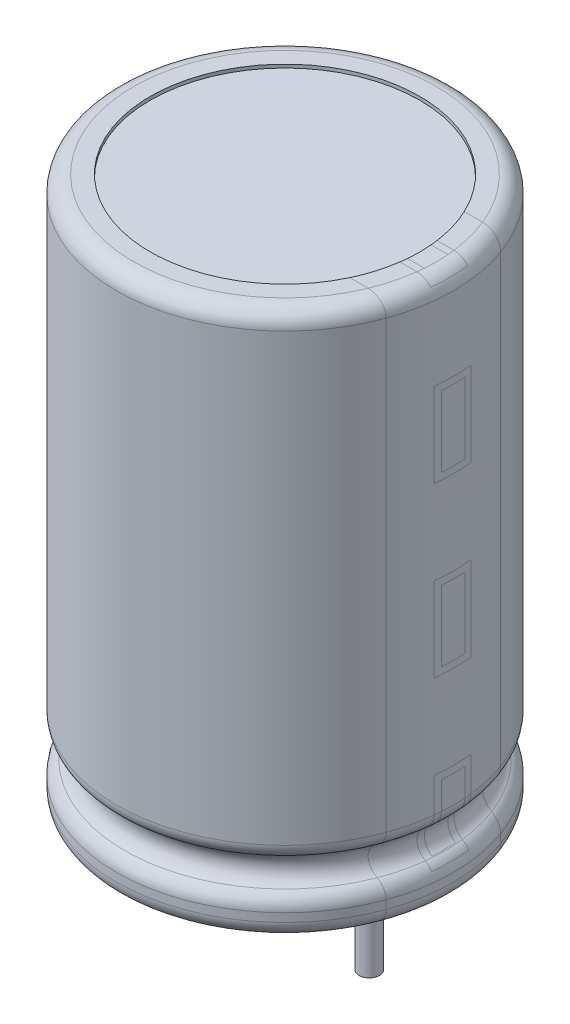
from build123d import *

# Parameters (mm, degrees)
BOSS_EXTRUDE1_DEPTH        = 1
BOSS_EXTRUDE1_DEPTH_BACK   = 3
SKETCH1_R                  = 0.3
BOSS_EXTRUDE1_2_DEPTH      = 1
BOSS_EXTRUDE1_2_DEPTH_BACK = 3


with BuildPart() as part:
    # Sketch1 → Boss-Extrude1 (new, two sides: drawn at the far end of the back side and taken through both)
    with BuildSketch(Plane(origin=(0, 0, 0), x_dir=(1, 0, 0), z_dir=(0, 1, 0)).offset(-BOSS_EXTRUDE1_DEPTH_BACK)):
        with Locations(Location((-2.5, 0, 0), (0, 0, 270))):
            Circle(SKETCH1_R)
    extrude(amount=BOSS_EXTRUDE1_DEPTH + BOSS_EXTRUDE1_DEPTH_BACK)



with BuildPart() as body_2:
    # Sketch1 → Boss-Extrude1 2 (new, two sides: drawn at the far end of the back side and taken through both)
    with BuildSketch(Plane(origin=(0, 0, 0), x_dir=(1, 0, 0), z_dir=(0, 1, 0)).offset(-BOSS_EXTRUDE1_2_DEPTH_BACK)):
        with Locations(Location((2.5, 0, 0), (0, 0, 90))):
            Circle(SKETCH1_R)
    extrude(amount=BOSS_EXTRUDE1_2_DEPTH + BOSS_EXTRUDE1_2_DEPTH_BACK)


with BuildPart() as part_1:
    add(part.part)

    add(body_2.part)  # Revolve1 merges body 2
    # Sketch3 → Revolve1 (revolve)
    with BuildSketch(Plane.XY):
        with BuildLine():
            Line((5, 0.5), (5, 0.75))
            ThreePointArc((5, 0.75), (4.933012702, 1), (4.75, 1.183012702))
            ThreePointArc((4.75, 1.183012702), (4.5, 1.616025404), (4.75, 2.049038106))
            ThreePointArc((4.75, 2.049038106), (4.933012702, 2.232050808), (5, 2.482050808))
            Line((5, 2.482050808), (5, 15.7))
            ThreePointArc((5, 15.7), (4.853553391, 16.053553391), (4.5, 16.2))
            Line((4.5, 16.2), (4, 16.2))
            Line((4, 16.2), (4, 16.1))
            Line((4, 16.1), (0, 16.1))
            Line((0, 16.1), (0, 0.1))
            Line((0, 0.1), (4, 0.1))
            Line((4, 0.1), (4, 0))
            Line((4, 0), (4.5, 0))
            ThreePointArc((4.5, 0), (4.853553391, 0.146446609), (5, 0.5))
        make_face()
    revolve(axis=Axis((0, 0.1, 0), (0, 1, 0)))


solid = part_1.part
